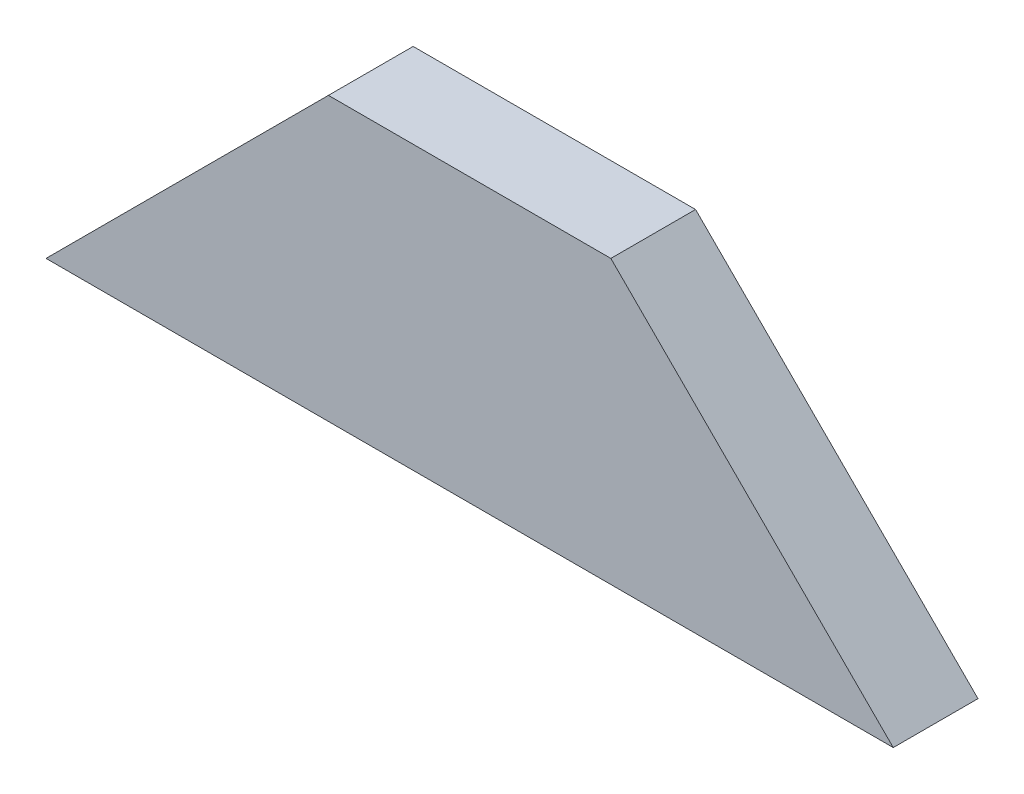
from build123d import *

# Parameters (mm, degrees)
EXTRUDE_1_DEPTH = 3


with BuildPart() as part:
    # 草图1 → 凸台-拉伸1 (new body)
    with BuildSketch(Plane.XY):
        Polygon((0, 0), (10, 10), (20, 10), (30, 0), align=None)
    extrude(amount=EXTRUDE_1_DEPTH)


solid = part.part
